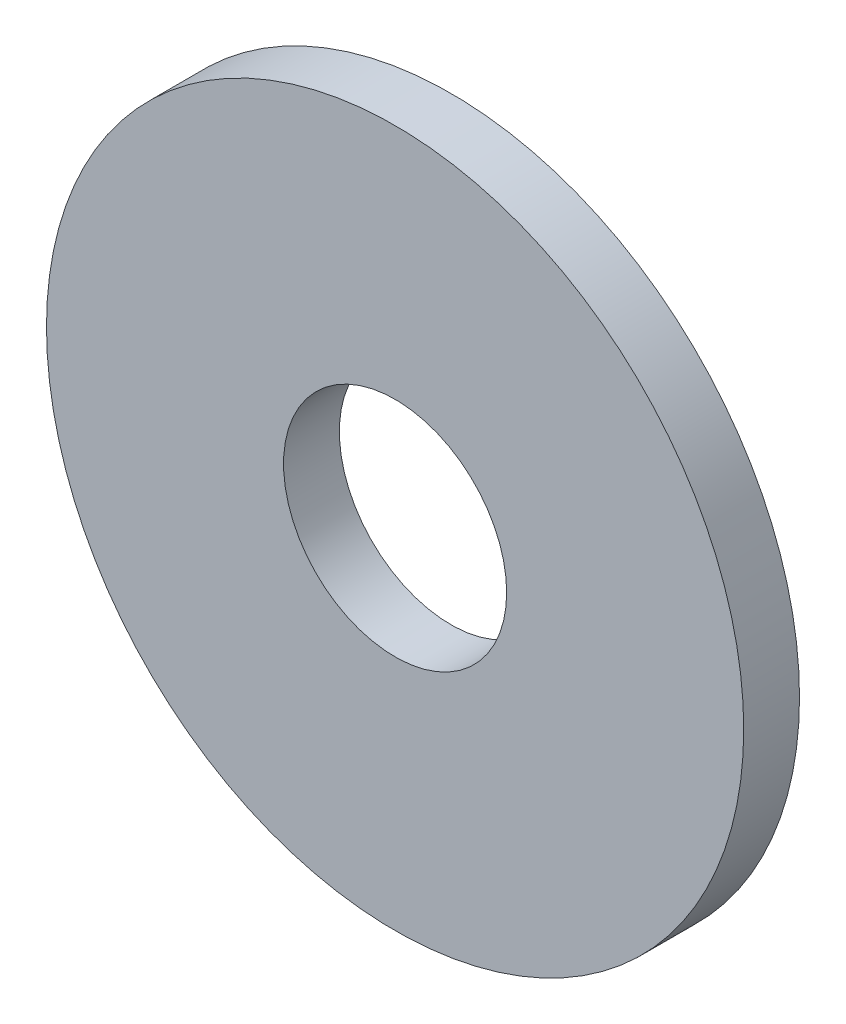
from build123d import *

# Parameters (mm, degrees)
S01_WIDE_WASHER_FOR_PIN_RETENTION_R      = 5
S01_WIDE_WASHER_FOR_PIN_RETENTION_R_2    = 1.6
F_01_WIDE_WASHER_FOR_PIN_RETENTION_DEPTH = 0.8


with BuildPart() as part:
    # S01 - Wide washer for pin retention → 01 - Wide washer for pin retention (new body)
    with BuildSketch(Plane.XY):
        Circle(S01_WIDE_WASHER_FOR_PIN_RETENTION_R)
        Circle(S01_WIDE_WASHER_FOR_PIN_RETENTION_R_2, mode=Mode.SUBTRACT)
    extrude(amount=F_01_WIDE_WASHER_FOR_PIN_RETENTION_DEPTH)


solid = part.part
